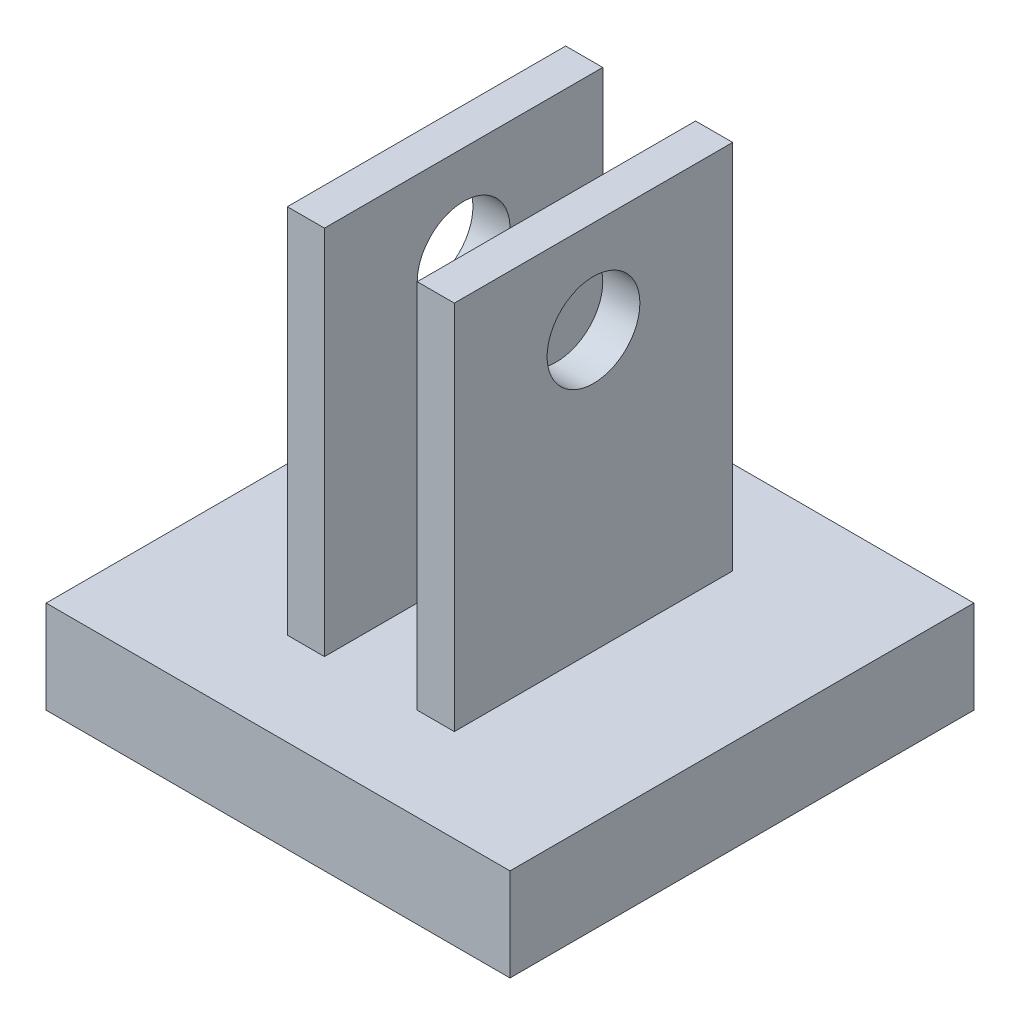
from build123d import *

# Parameters (mm, degrees)
SKETCH1_W           = 25
SKETCH1_H           = 25
BOSS_EXTRUDE1_DEPTH = 5
SKETCH10_W          = 2
SKETCH10_H          = 15
BOSS_EXTRUDE3_DEPTH = 20
SKETCH13_R          = 2.5
CUT_EXTRUDE3_DEPTH  = 33.714675606


with BuildPart() as part:
    # Sketch1 → Boss-Extrude1 (new body)
    with BuildSketch(Plane(origin=(0, 0, 0), x_dir=(1, 0, 0), z_dir=(0, 1, 0))):
        Rectangle(SKETCH1_W, SKETCH1_H)
    extrude(amount=BOSS_EXTRUDE1_DEPTH)

    # Sketch10 → Boss-Extrude3 (add)
    with BuildSketch(Plane(origin=(0, 5, 0), x_dir=(1, 0, 0), z_dir=(0, 1, 0))):
        with Locations((3.5, 0)):
            Rectangle(SKETCH10_W, SKETCH10_H)
    extrude(amount=BOSS_EXTRUDE3_DEPTH)

    # Mirror1: part across plane


with BuildPart() as part_1:
    add(part.part)
    add(part.part.mirror(Plane(origin=(0, 0, 0), x_dir=(0, 0, 1), z_dir=(1, 0, 0))))

    # Sketch13 → Cut-Extrude3 (cut, through all)
    with BuildSketch(Plane.ZY.offset(4.5)):
        with Locations((0, 20)):
            Circle(SKETCH13_R)
    extrude(amount=-CUT_EXTRUDE3_DEPTH, mode=Mode.SUBTRACT)


solid = part_1.part
